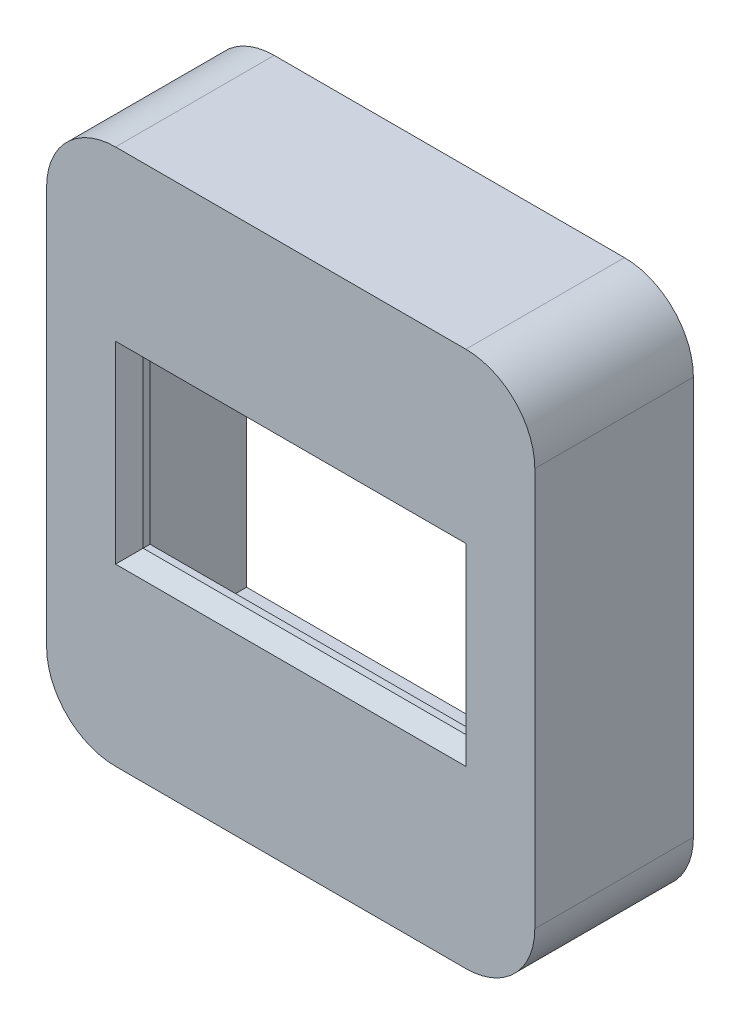
from build123d import *

# Parameters (mm, degrees)
SKETCH2_W           = 35.4
SKETCH2_H           = 38.9
BOSS_EXTRUDE1_DEPTH = 1.5
SKETCH4_W           = 23.4
SKETCH4_H           = 12
CUT_EXTRUDE1_DEPTH  = 1.5
SKETCH5_W           = 35.4
SKETCH5_H           = 38.9
SKETCH5_W_2         = 29.4
SKETCH5_H_2         = 27.2
BOSS_EXTRUDE2_DEPTH = 10
FILLET1_R           = 5
SKETCH7_W           = 14.16
SKETCH7_H           = 5.2
CUT_EXTRUDE2_DEPTH  = 10
SKETCH8_W           = 7
SKETCH8_H           = 5.2
BOSS_EXTRUDE3_DEPTH = 1.8
BOSS_EXTRUDE4_DEPTH = 7.62
SKETCH10_R          = 0.95
BOSS_EXTRUDE5_DEPTH = 2
CHAMFER1_SIZE       = 1


with BuildPart() as part:
    # Sketch2 → Boss-Extrude1 (new body)
    with BuildSketch(Plane.XY):
        with Locations((0, 1.35)):
            Rectangle(SKETCH2_W, SKETCH2_H)
    extrude(amount=BOSS_EXTRUDE1_DEPTH)

    # Sketch4 → Cut-Extrude1 (cut)
    with BuildSketch(Plane(origin=(0, 0, 0), x_dir=(-1, 0, 0), z_dir=(0, 0, -1))):
        with Locations((0, 1.6)):
            Rectangle(SKETCH4_W, SKETCH4_H)
    extrude(amount=-CUT_EXTRUDE1_DEPTH, mode=Mode.SUBTRACT)

    # Sketch5 → Boss-Extrude2 (add)
    with BuildSketch(Plane(origin=(0, 0, 0), x_dir=(-1, 0, 0), z_dir=(0, 0, -1))):
        with Locations((0, 1.35)):
            Rectangle(SKETCH5_W, SKETCH5_H)
        Rectangle(SKETCH5_W_2, SKETCH5_H_2, mode=Mode.SUBTRACT)
    extrude(amount=BOSS_EXTRUDE2_DEPTH)

    # Fillet1
    fillet1_edges = [part.edges().sort_by_distance(p)[0] for p in [
        (-17.7, 20.8, -4.25),
        (17.7, 20.8, -4.25),
        (17.7, -18.1, -4.25),
        (-17.7, -18.1, -4.25),
    ]]
    fillet(fillet1_edges, radius=FILLET1_R)

    # Sketch7 → Cut-Extrude2 (cut)
    with BuildSketch(Plane(origin=(0, 0, -10), x_dir=(-1, 0, 0), z_dir=(0, 0, -1))):
        with Locations((0, 16.2)):
            Rectangle(SKETCH7_W, SKETCH7_H)
    extrude(amount=-CUT_EXTRUDE2_DEPTH, mode=Mode.SUBTRACT)

    # Sketch8 → Boss-Extrude3 (add)
    with BuildSketch(Plane(origin=(0, 0, 0), x_dir=(-1, 0, 0), z_dir=(0, 0, -1))):
        with Locations((11.2, -11)):
            Rectangle(SKETCH8_W, SKETCH8_H)
        with Locations((11.2, 11)):
            Rectangle(SKETCH8_W, SKETCH8_H)
        with Locations((-11.2, 11)):
            Rectangle(SKETCH8_W, SKETCH8_H)
        with Locations((-11.2, -11)):
            Rectangle(SKETCH8_W, SKETCH8_H)
    extrude(amount=BOSS_EXTRUDE3_DEPTH)

    # Sketch9 → Boss-Extrude4 (add)
    with BuildSketch(Plane(origin=(-14.7, 0, 0), x_dir=(0, 0, -1), z_dir=(1, 0, 0))):
        Polygon((3.5, 13.6), (10, 12.6), (10, 13.6), align=None)
    boss_extrude4 = extrude(amount=BOSS_EXTRUDE4_DEPTH)

    # Mirror1: Boss-Extrude4 across plane
    add(boss_extrude4.mirror(Plane(origin=(0, 0, 0), x_dir=(0, 0, 1), z_dir=(1, 0, 0))))

    # Sketch10 → Boss-Extrude5 (add)
    with BuildSketch(Plane(origin=(0, 0, -1.8), x_dir=(-1, 0, 0), z_dir=(0, 0, -1))):
        with Locations(Location((10.2, -12, 0), (0, 0, 180))):
            Circle(SKETCH10_R)
    boss_extrude5 = extrude(amount=BOSS_EXTRUDE5_DEPTH)

    # Mirror2: Boss-Extrude5 across plane
    add(boss_extrude5.mirror(Plane(origin=(0, 0, 0), x_dir=(0, 0, 1), z_dir=(1, 0, 0))))

    # Chamfer1
    chamfer1_edges = [part.edges().sort_by_distance(p)[0] for p in [
        (-11.7, 1.6, 1.5),
        (0, -4.4, 1.5),
        (11.7, 1.6, 1.5),
        (0, 7.6, 1.5),
    ]]
    chamfer(chamfer1_edges, length=CHAMFER1_SIZE)


solid = part.part
